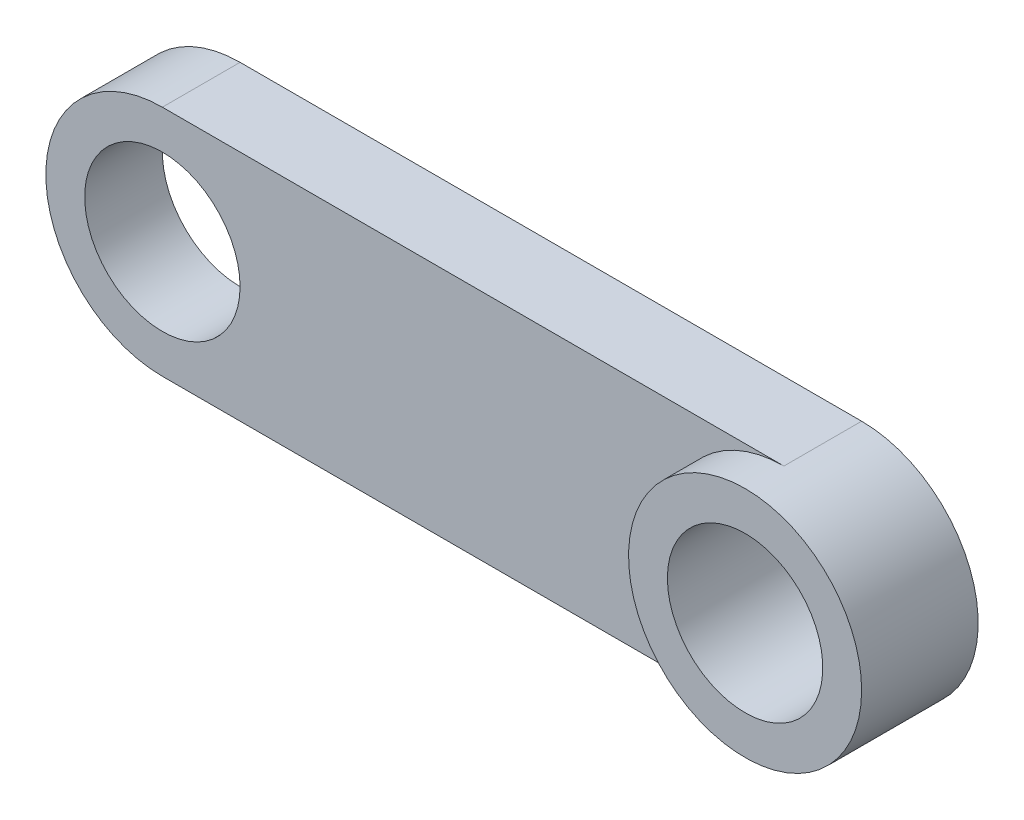
from build123d import *

# Parameters (mm, degrees)
SKETCH1_R           = 6.35
BOSS_EXTRUDE1_DEPTH = 6.35
SKETCH2_R           = 9.525
BOSS_EXTRUDE2_DEPTH = 3.175
SKETCH3_R           = 6.35
CUT_EXTRUDE1_DEPTH  = 43.709869791


with BuildPart() as part:
    # Sketch1 → Boss-Extrude1 (new body)
    with BuildSketch(Plane.XY):
        with BuildLine():
            Line((-30.746408046, 10.565086207), (20.053591954, 10.565086207))
            ThreePointArc((20.053591954, 10.565086207), (29.578591954, 1.040086207), (20.053591954, -8.484913793))
            Line((20.053591954, -8.484913793), (-30.746408046, -8.484913793))
            ThreePointArc((-30.746408046, -8.484913793), (-40.271408046, 1.040086207), (-30.746408046, 10.565086207))
        make_face()
        with Locations((-30.746408046, 1.040086207)):
            Circle(SKETCH1_R, mode=Mode.SUBTRACT)
        with Locations((20.053591954, 1.040086207)):
            Circle(SKETCH1_R, mode=Mode.SUBTRACT)
    extrude(amount=BOSS_EXTRUDE1_DEPTH)

    # Sketch2 → Boss-Extrude2 (add)
    with BuildSketch(Plane.XY.offset(6.35)):
        with Locations(Location((20.053591954, 1.040086207, 0), (0, 0, 90))):
            Circle(SKETCH2_R)
    extrude(amount=BOSS_EXTRUDE2_DEPTH)

    # Sketch3 → Cut-Extrude1 (cut, through all)
    with BuildSketch(Plane(origin=(0, 0, 0), x_dir=(-1, 0, 0), z_dir=(0, 0, -1))):
        with Locations((-20.053591954, 1.040086207)):
            Circle(SKETCH3_R)
    extrude(amount=-CUT_EXTRUDE1_DEPTH, mode=Mode.SUBTRACT)


solid = part.part
